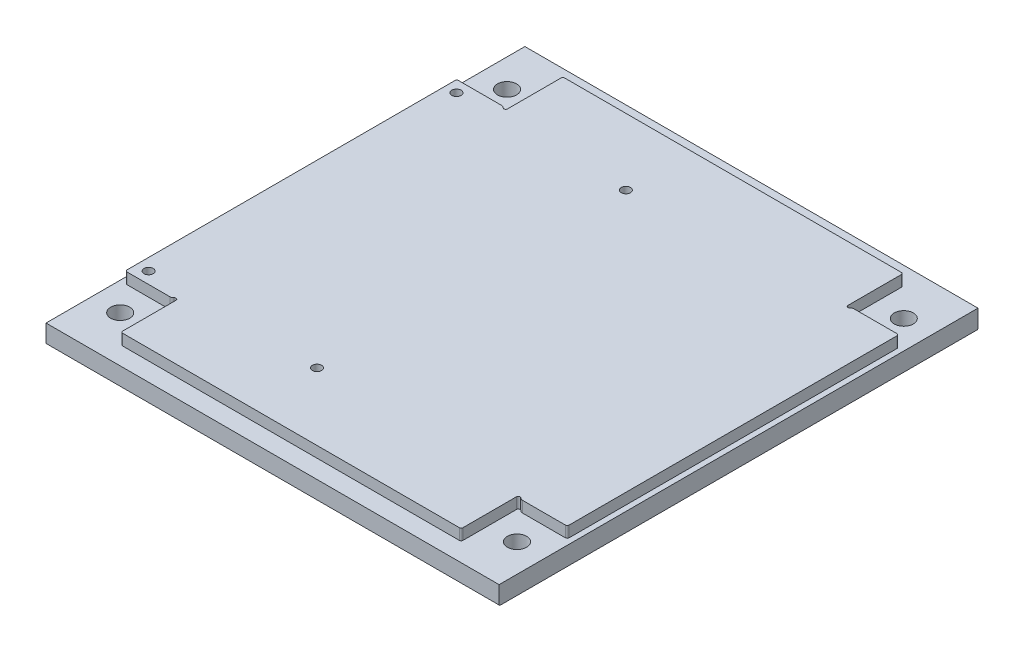
from build123d import *

# Parameters (mm, degrees)
SKETCH_1_W                  = 123
SKETCH_1_H                  = 130
EXTRUDE_1_DEPTH             = 5
EXTRUDE_2_DEPTH             = 3
HOLE_WIZARD_13_0_13_1_D     = 13
HOLE_WIZARD_13_0_13_1_DEPTH = 6
HOLE_WIZARD_2_5_2_5_1_D     = 2.5
HOLE_WIZARD_2_5_2_5_1_DEPTH = 5
HOLE_WIZARD_3_3_3_3_1_D     = 3.3
HOLE_WIZARD_3_3_3_3_1_DEPTH = 6
HOLE_WIZARD_1_D             = 5.2
HOLE_WIZARD_1_DEPTH         = 8
HOLE_WIZARD_1_CBORE_D       = 11
HOLE_WIZARD_1_CBORE_DEPTH   = 1
CHAMFER_1_SIZE              = 0.2
FILLET_1_R                  = 0.5
FILLET_2_R                  = 1


with BuildPart() as part:
    # 草图1 → 凸台-拉伸1 (new body)
    with BuildSketch(Plane(origin=(0, 0, 0), x_dir=(1, 0, 0), z_dir=(0, 1, 0))):
        Rectangle(SKETCH_1_W, SKETCH_1_H)
    extrude(amount=-EXTRUDE_1_DEPTH)

    # 草图2 → 凸台-拉伸2 (add)
    with BuildSketch(Plane(origin=(0, 0, 0), x_dir=(-1, 0, 0), z_dir=(0, 1, 0))):
        with BuildLine():
            Line((46.2, -45), (46.2, -60))
            Line((46.2, -60), (-46.2, -60))
            Line((-46.2, -60), (-46.2, -45))
            ThreePointArc((-46.2, -45), (-46.7, -44.5), (-47.2, -45))
            Line((-47.2, -45), (-60, -45))
            Line((-60, -45), (-60, 45))
            Line((-60, 45), (-47.2, 45))
            ThreePointArc((-47.2, 45), (-46.7, 44.5), (-46.2, 45))
            Line((-46.2, 45), (-46.2, 60))
            Line((-46.2, 60), (46.2, 60))
            Line((46.2, 60), (46.2, 45))
            ThreePointArc((46.2, 45), (46.7, 44.5), (47.2, 45))
            Line((47.2, 45), (60, 45))
            Line((60, 45), (60, -45))
            Line((60, -45), (47.2, -45))
            ThreePointArc((47.2, -45), (46.7, -44.5), (46.2, -45))
        make_face()
    extrude(amount=EXTRUDE_2_DEPTH)

    # Ø13.0 (13) 直径孔1
    with Locations(Plane(origin=(0, -5, 0), x_dir=(-1, 0, 0), z_dir=(0, -1, 0))):
        with Locations((0, 0)):
            Hole(HOLE_WIZARD_13_0_13_1_D / 2, depth=HOLE_WIZARD_13_0_13_1_DEPTH)

    # Ø2.5 (2.5) 直径孔1
    with Locations(Plane(origin=(0, 3, 0), x_dir=(1, 0, 0), z_dir=(0, 1, 0))):
        with Locations((-56.780566421, -41.855346711), (-11.041427483, 41.956342393), (-56.907566675, 41.837820676), (-11.168427737, -41.75982474)):
            Hole(HOLE_WIZARD_2_5_2_5_1_D / 2, depth=HOLE_WIZARD_2_5_2_5_1_DEPTH)

    # Ø3.3 (3.3) 直径孔1
    with Locations(Plane(origin=(0, -5, 0), x_dir=(-1, 0, 0), z_dir=(0, -1, 0))):
        with Locations((-14.722431864, -8.5), (-14.722431864, 8.5), (0, 17), (14.722431864, 8.5), (14.722431864, -8.5), (0, -17)):
            Hole(HOLE_WIZARD_3_3_3_3_1_D / 2, depth=HOLE_WIZARD_3_3_3_3_1_DEPTH)

    # 孔1
    with Locations(Plane(origin=(0, -5, 0), x_dir=(-1, 0, 0), z_dir=(0, -1, 0))):
        with Locations((53.85, 52.5), (-53.85, -52.5), (53.85, -52.5), (-53.85, 52.5)):
            CounterBoreHole(HOLE_WIZARD_1_D / 2, HOLE_WIZARD_1_CBORE_D / 2, HOLE_WIZARD_1_CBORE_DEPTH, depth=HOLE_WIZARD_1_DEPTH)

    # 倒角1
    chamfer_1_edges = [part.edges().sort_by_distance(p)[0] for p in [
        (0, -5, 65),
        (0, -5, -65),
    ]]
    chamfer(chamfer_1_edges, length=CHAMFER_1_SIZE)

    # 圆角1
    fillet_1_edges = [part.edges().sort_by_distance(p)[0] for p in [
        (-60, 1.5, -45),
        (-60, 1.5, 45),
        (-46.2, 1.5, 60),
        (46.2, 1.5, 60),
        (60, 1.5, 45),
        (60, 1.5, -45),
        (46.2, 1.5, -60),
        (-46.2, 1.5, -60),
    ]]
    fillet(fillet_1_edges, radius=FILLET_1_R)

    # 圆角2
    fillet_2_edges = [part.edges().sort_by_distance(p)[0] for p in [
        (-47.2, 1.5, -45),
        (-47.2, 1.5, 45),
        (47.2, 1.5, 45),
        (47.2, 1.5, -45),
    ]]
    fillet(fillet_2_edges, radius=FILLET_2_R)


solid = part.part
